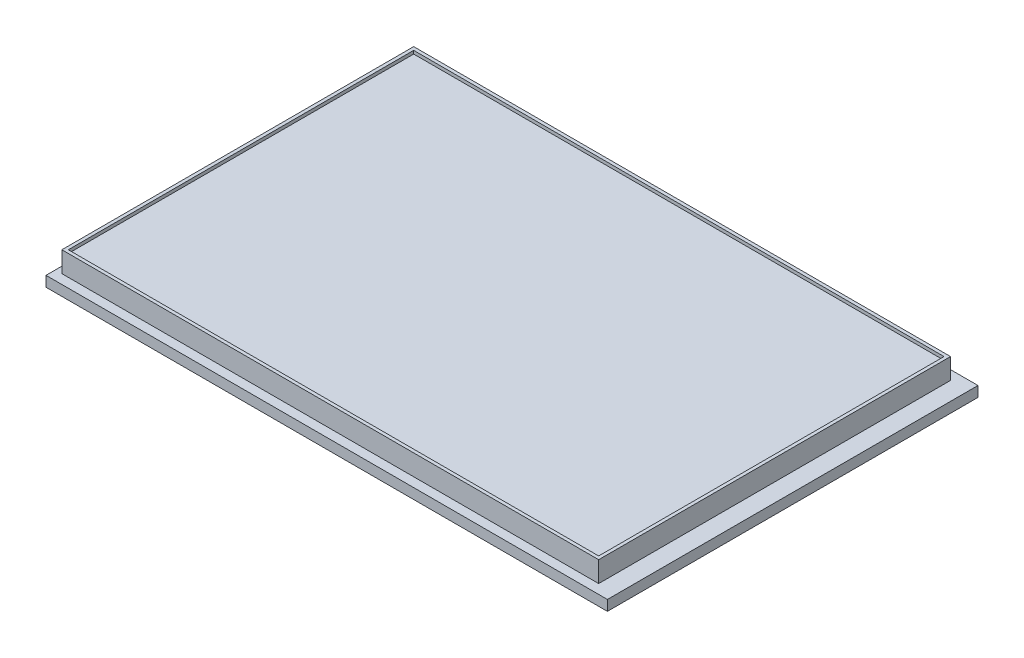
from build123d import *

# Parameters (mm, degrees)
SKETCH1_W           = 86.8
SKETCH1_H           = 57.3
BOSS_EXTRUDE1_DEPTH = 1.6
SKETCH2_W           = 83
SKETCH2_H           = 54.4
BOSS_EXTRUDE2_DEPTH = 3.2
SKETCH3_W           = 82
SKETCH3_H           = 53.4
CUT_EXTRUDE1_DEPTH  = 0.5


with BuildPart() as part:
    # Sketch1 → Boss-Extrude1 (new body)
    with BuildSketch(Plane(origin=(0, 0, 0), x_dir=(1, 0, 0), z_dir=(0, 1, 0))):
        Rectangle(SKETCH1_W, SKETCH1_H)
    extrude(amount=BOSS_EXTRUDE1_DEPTH)

    # Sketch2 → Boss-Extrude2 (add)
    with BuildSketch(Plane(origin=(0, 1.6, 0), x_dir=(1, 0, 0), z_dir=(0, 1, 0))):
        with Locations((-0.9, 0)):
            Rectangle(SKETCH2_W, SKETCH2_H)
    extrude(amount=BOSS_EXTRUDE2_DEPTH)

    # Sketch3 → Cut-Extrude1 (cut)
    with BuildSketch(Plane(origin=(0, 4.8, 0), x_dir=(1, 0, 0), z_dir=(0, 1, 0))):
        with Locations((-0.9, 0)):
            Rectangle(SKETCH3_W, SKETCH3_H)
    extrude(amount=-CUT_EXTRUDE1_DEPTH, mode=Mode.SUBTRACT)


solid = part.part
